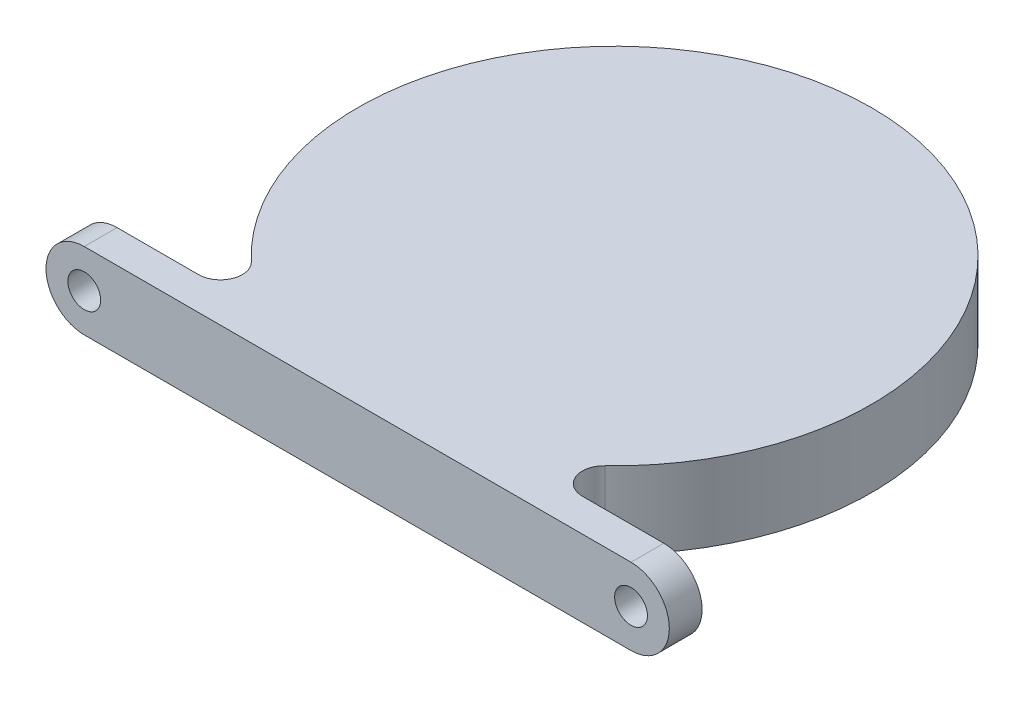
from build123d import *

# Parameters (mm, degrees)
SKETCH1_R           = 23.5
BOSS_EXTRUDE1_DEPTH = 7
SKETCH2_R           = 1.5
BOSS_EXTRUDE2_DEPTH = 3
FILLET1_R           = 2


with BuildPart() as part:
    # Sketch1 → Boss-Extrude1 (new body)
    with BuildSketch(Plane(origin=(0, 0, 0), x_dir=(1, 0, 0), z_dir=(0, 1, 0))):
        with Locations(Location((0, 0, 0), (0, 0, 270))):
            Circle(SKETCH1_R)
    extrude(amount=BOSS_EXTRUDE1_DEPTH)

    # Sketch2 → Boss-Extrude2 (add)
    with BuildSketch(Plane.XY.offset(23.5)):
        with BuildLine():
            Line((-25, 0), (25, 0))
            ThreePointArc((25, 0), (28.5, 3.5), (25, 7))
            Line((25, 7), (-25, 7))
            ThreePointArc((-25, 7), (-28.5, 3.5), (-25, 0))
        make_face()
        with Locations((25, 3.5)):
            Circle(SKETCH2_R, mode=Mode.SUBTRACT)
        with Locations((-25, 3.5)):
            Circle(SKETCH2_R, mode=Mode.SUBTRACT)
    extrude(amount=-BOSS_EXTRUDE2_DEPTH)

    # Fillet1
    fillet1_edges = [part.edges().sort_by_distance(p)[0] for p in [
        (-11.489125293, 3.5, 20.5),
        (11.489125293, 3.5, 20.5),
    ]]
    fillet(fillet1_edges, radius=FILLET1_R)


solid = part.part
